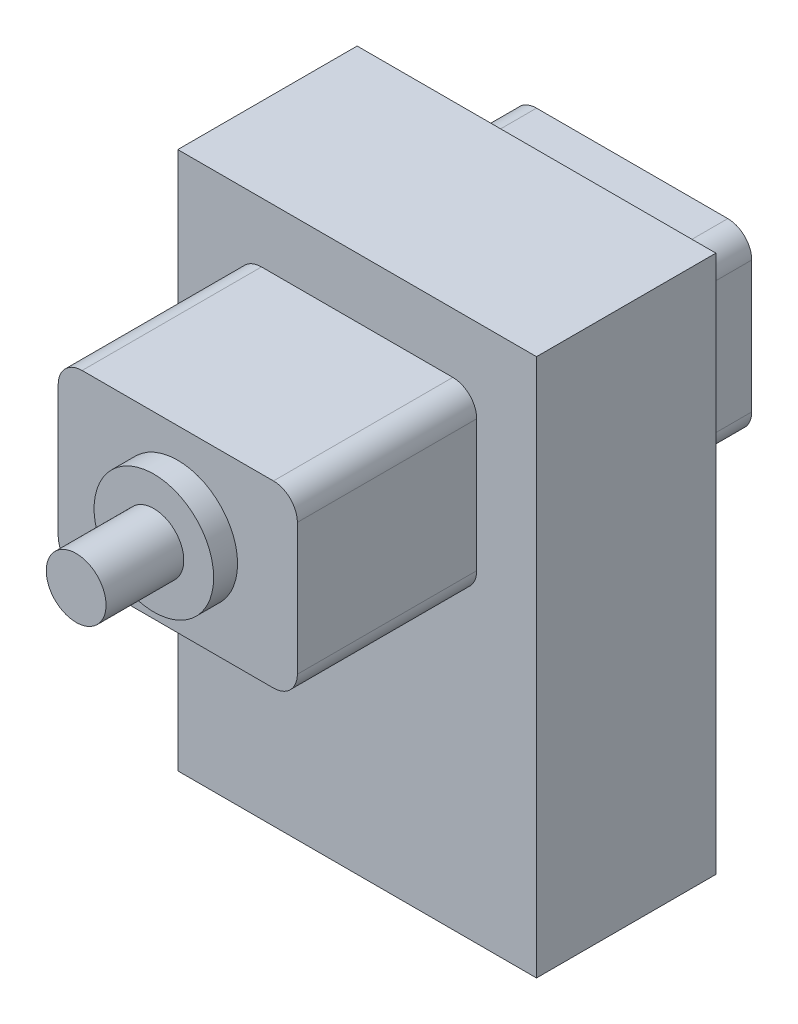
from build123d import *

# Parameters (mm, degrees)
SKETCH3_W           = 30
SKETCH3_H           = 45
BOSS_EXTRUDE1_DEPTH = 15
SKETCH4_W           = 20
SKETCH4_H           = 15
BOSS_EXTRUDE2_DEPTH = 15
SKETCH5_W           = 20
SKETCH5_H           = 15
BOSS_EXTRUDE3_DEPTH = 8
FILLET1_R           = 2
SKETCH6_R           = 5
BOSS_EXTRUDE4_DEPTH = 2
SKETCH7_R           = 2.5
BOSS_EXTRUDE5_DEPTH = 6.5


with BuildPart() as part:
    # Sketch3 → Boss-Extrude1 (new body)
    with BuildSketch(Plane.XY):
        with Locations((-15, 22.5)):
            Rectangle(SKETCH3_W, SKETCH3_H)
    extrude(amount=BOSS_EXTRUDE1_DEPTH)

    # Sketch4 → Boss-Extrude2 (add)
    with BuildSketch(Plane.XY.offset(15)):
        with Locations((-15, 32.5)):
            Rectangle(SKETCH4_W, SKETCH4_H)
    extrude(amount=BOSS_EXTRUDE2_DEPTH)

    # Sketch5 → Boss-Extrude3 (add)
    with BuildSketch(Plane(origin=(0, 0, 0), x_dir=(-1, 0, 0), z_dir=(0, 0, -1))):
        with Locations((15, 32.5)):
            Rectangle(SKETCH5_W, SKETCH5_H)
    extrude(amount=BOSS_EXTRUDE3_DEPTH)

    # Fillet1
    fillet1_edges = [part.edges().sort_by_distance(p)[0] for p in [
        (-25, 40, 22.5),
        (-25, 25, 22.5),
        (-5, 25, 22.5),
        (-5, 40, 22.5),
        (-5, 40, -4),
        (-5, 25, -4),
        (-25, 25, -4),
        (-25, 40, -4),
    ]]
    fillet(fillet1_edges, radius=FILLET1_R)

    # Sketch6 → Boss-Extrude4 (add)
    with BuildSketch(Plane.XY.offset(30)):
        with Locations((-15, 32.5)):
            Circle(SKETCH6_R)
    extrude(amount=BOSS_EXTRUDE4_DEPTH)

    # Sketch7 → Boss-Extrude5 (add)
    with BuildSketch(Plane.XY.offset(32)):
        with Locations(Location((-15, 32.5, 0), (0, 0, 180))):
            Circle(SKETCH7_R)
    extrude(amount=BOSS_EXTRUDE5_DEPTH)


solid = part.part
